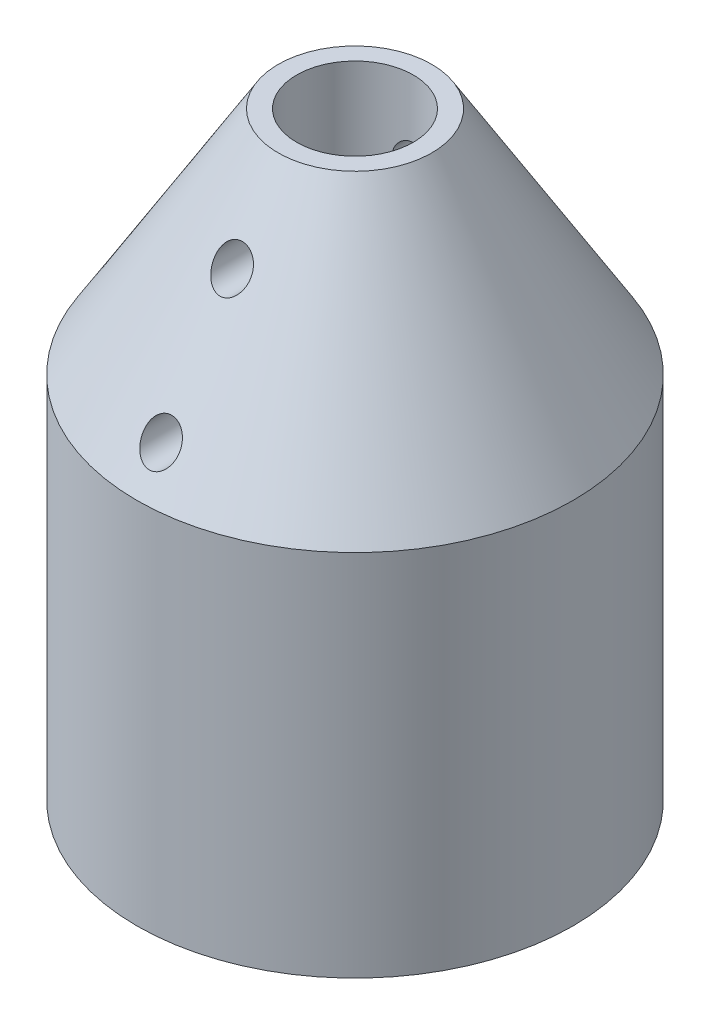
from build123d import *

# Parameters (mm, degrees)
SKETCH3_R               = 4.826
CUT_EXTRUDE1_DEPTH      = 25.4
CUT_EXTRUDE2_DEPTH      = 56.71060233
CUT_EXTRUDE2_DEPTH_BACK = 56.71060233
SKETCH4_R               = 1.5
SKETCH5_R               = 1.5
CUT_EXTRUDE3_DEPTH      = 6.35
CIRPATTERN1_COUNT       = 8
SKETCH6_R               = 4.7625
BOSS_EXTRUDE1_DEPTH     = 9.525
CHAMFER1_SIZE           = 0.635


with BuildPart() as part:
    # 草图1 → 旋转1 (revolve)
    with BuildSketch(Plane.XY, mode=Mode.PRIVATE) as revolve_1_sk:
        Polygon((0, 0), (0, 30.48), (0, 49.53), (6.35, 49.53), (18.034, 30.48), (18.034, 0), align=None)
    revolve(revolve_1_sk.sketch.rotate(Axis((0, 0, 0), (0, 1, 0)), 90), axis=Axis((0, 0, 0), (0, 1, 0)))

    # Sketch3 → Cut-Extrude1 (cut)
    with BuildSketch(Plane(origin=(0, 49.53, 0), x_dir=(1, 0, 0), z_dir=(0, 1, 0))):
        with Locations(Location((0, 0, 0), (0, 0, 270))):
            Circle(SKETCH3_R)
    extrude(amount=-CUT_EXTRUDE1_DEPTH, mode=Mode.SUBTRACT)

    # Sketch4 → Cut-Extrude2 (cut, two sides: drawn at the far end of the back side and taken through both)
    with BuildSketch(Plane.XY.offset(-CUT_EXTRUDE2_DEPTH_BACK)):
        with Locations((0, 43.18)):
            Circle(SKETCH4_R)
        with Locations((0, 33.655)):
            Circle(SKETCH4_R)
    extrude(amount=CUT_EXTRUDE2_DEPTH + CUT_EXTRUDE2_DEPTH_BACK, mode=Mode.SUBTRACT)

    # Sketch5 → Cut-Extrude3 (cut)
    with BuildSketch(Plane.XZ):
        with Locations(Location((0, 9.525, 0), (0, 0, 270))):
            Circle(SKETCH5_R)
    cut_extrude3 = extrude(amount=-CUT_EXTRUDE3_DEPTH, mode=Mode.SUBTRACT)

    # CirPattern1: Cut-Extrude3 ×8 about axis
    cirpattern1_axis = Axis((0, 0, 0), (0, 1, 0))
    for i in range(1, CIRPATTERN1_COUNT):
        add(cut_extrude3.rotate(cirpattern1_axis, i * 360 / CIRPATTERN1_COUNT), mode=Mode.SUBTRACT)

    # Sketch6 → Boss-Extrude1 (add)
    with BuildSketch(Plane.XZ):
        with Locations(Location((0, 0, 0), (0, 0, 90))):
            Circle(SKETCH6_R)
    extrude(amount=BOSS_EXTRUDE1_DEPTH)

    # Chamfer1
    chamfer1_edges = [part.edges().sort_by_distance(p)[0] for p in [
        (0, -9.525, -4.7625),
    ]]
    chamfer(chamfer1_edges, length=CHAMFER1_SIZE)

    # Sketch7 → Revolve1 (revolve)
    with BuildSketch(Plane.XY, mode=Mode.PRIVATE) as revolve1_sk:
        Polygon((-5.588, 0), (-4.7625, -2.2225), (-4.7625, 0), align=None)
    revolve(revolve1_sk.sketch.rotate(Axis((0, 0, 0), (0, -1, 0)), 90), axis=Axis((0, 0, 0), (0, -1, 0)))


solid = part.part
